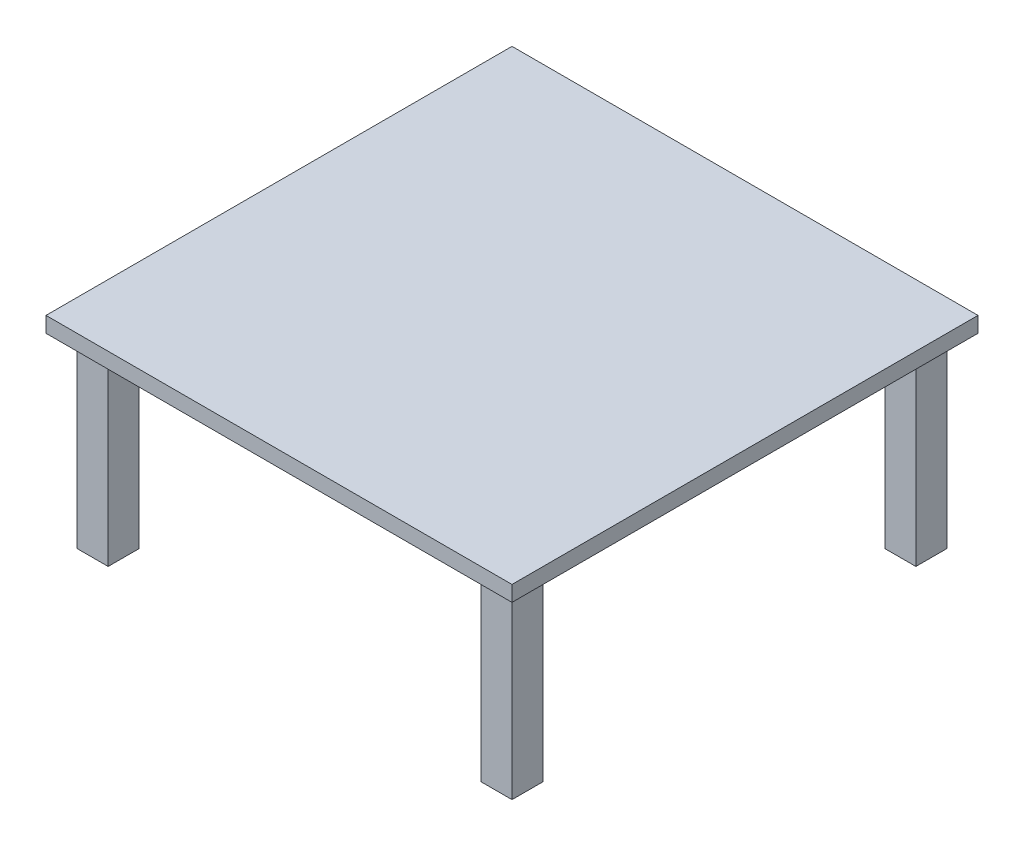
from build123d import *

# Parameters (mm, degrees)
SKETCH_2_W      = 30
SKETCH_2_H      = 30
EXTRUDE_1_DEPTH = 1
SKETCH_3_W      = 2
SKETCH_3_H      = 2
EXTRUDE_2_DEPTH = 12


with BuildPart() as part:
    # 草圖2 → 填料-伸長1 (new body)
    with BuildSketch(Plane(origin=(0, 0, 0), x_dir=(1, 0, 0), z_dir=(0, 1, 0))):
        Rectangle(SKETCH_2_W, SKETCH_2_H)
    extrude(amount=EXTRUDE_1_DEPTH)

    # 草圖3 → 填料-伸長2 (add)
    with BuildSketch(Plane.XZ):
        with Locations((-13, 13)):
            Rectangle(SKETCH_3_W, SKETCH_3_H)
        with Locations((13, 13)):
            Rectangle(SKETCH_3_W, SKETCH_3_H)
        with Locations((13, -13)):
            Rectangle(SKETCH_3_W, SKETCH_3_H)
        with Locations((-13, -13)):
            Rectangle(SKETCH_3_W, SKETCH_3_H)
    extrude(amount=EXTRUDE_2_DEPTH)


solid = part.part
